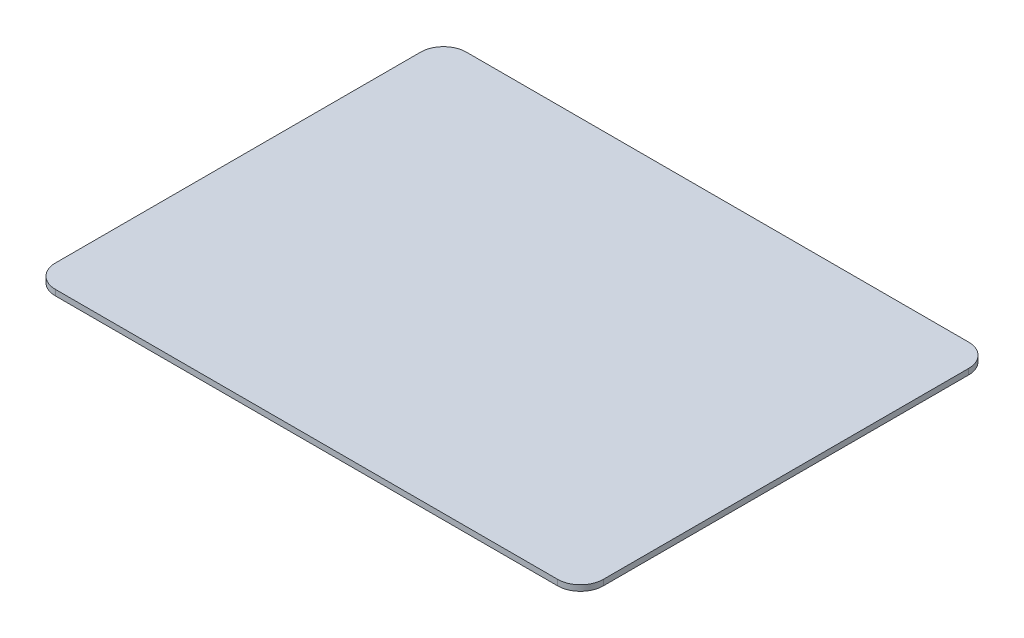
from build123d import *

# Parameters (mm, degrees)
BOSS_EXTRUDE1_DEPTH = 3.175


with BuildPart() as part:
    # Sketch1 → Boss-Extrude1 (new body)
    with BuildSketch(Plane(origin=(0, 0, 0), x_dir=(1, 0, 0), z_dir=(0, 1, 0))):
        with BuildLine():
            Line((-139.7, -114.3), (139.7, -114.3))
            ThreePointArc((139.7, -114.3), (148.680256121, -110.580256121), (152.4, -101.6))
            Line((152.4, -101.6), (152.4, 101.6))
            ThreePointArc((152.4, 101.6), (148.680256121, 110.580256121), (139.7, 114.3))
            Line((139.7, 114.3), (-139.7, 114.3))
            ThreePointArc((-139.7, 114.3), (-148.680256121, 110.580256121), (-152.4, 101.6))
            Line((-152.4, 101.6), (-152.4, -101.6))
            ThreePointArc((-152.4, -101.6), (-148.680256121, -110.580256121), (-139.7, -114.3))
        make_face()
    extrude(amount=BOSS_EXTRUDE1_DEPTH)


solid = part.part
